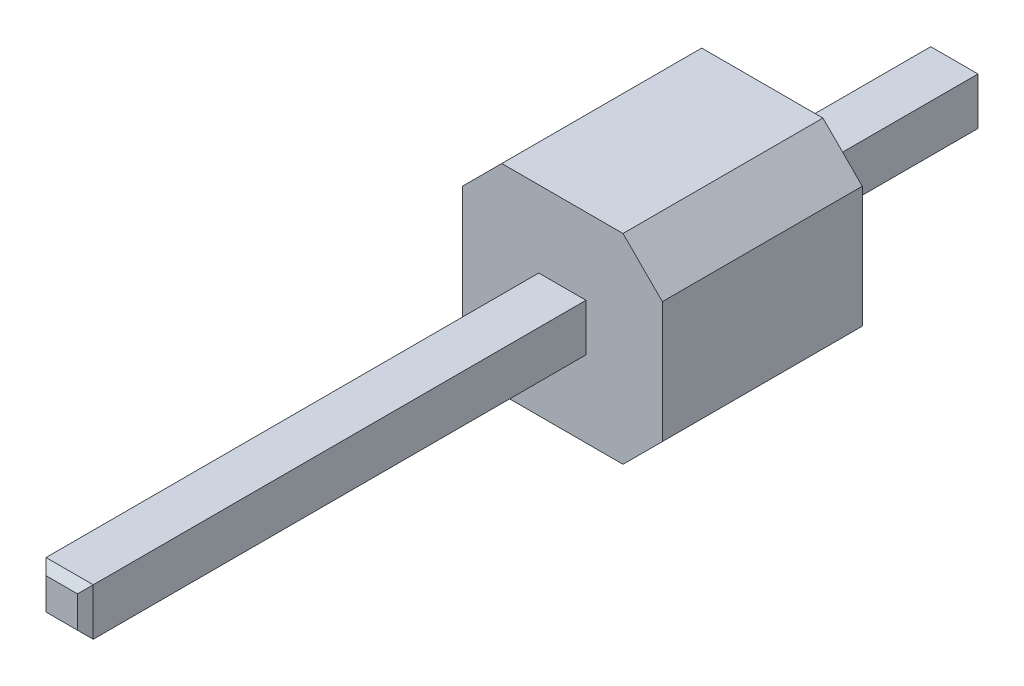
from build123d import *

# Parameters (mm, degrees)
PLASTIC_DEPTH = 2.54
SKETCH2_W     = 11.44
SKETCH2_H     = 0.6
CONTACT_DEPTH = 0.3
CHAMFER1_SIZE = 0.1


with BuildPart() as part:
    # Sketch1 → Plastic (new body)
    with BuildSketch(Plane.XY):
        Polygon((-0.77, 1.27), (0.77, 1.27), (1.27, 0.77), (1.27, -0.77), (0.77, -1.27), (-0.77, -1.27), (-1.27, -0.77), (-1.27, 0.77), align=None)
    extrude(amount=PLASTIC_DEPTH)

    # Sketch2 → Contact (add, symmetric)
    with BuildSketch(Plane(origin=(0, 0, 0), x_dir=(0, 0, -1), z_dir=(1, 0, 0))):
        with Locations((-3.18, 0)):
            Rectangle(SKETCH2_W, SKETCH2_H)
    extrude(amount=CONTACT_DEPTH, both=True)

    # Chamfer1
    chamfer1_edges = [part.edges().sort_by_distance(p)[0] for p in [
        (0, -0.3, 8.9),
        (0.3, 0, 8.9),
        (-0.3, 0, -2.54),
        (0, -0.3, -2.54),
        (0, 0.3, -2.54),
        (-0.3, 0, 8.9),
        (0, 0.3, 8.9),
        (0.3, 0, -2.54),
    ]]
    chamfer(chamfer1_edges, length=CHAMFER1_SIZE)


solid = part.part
